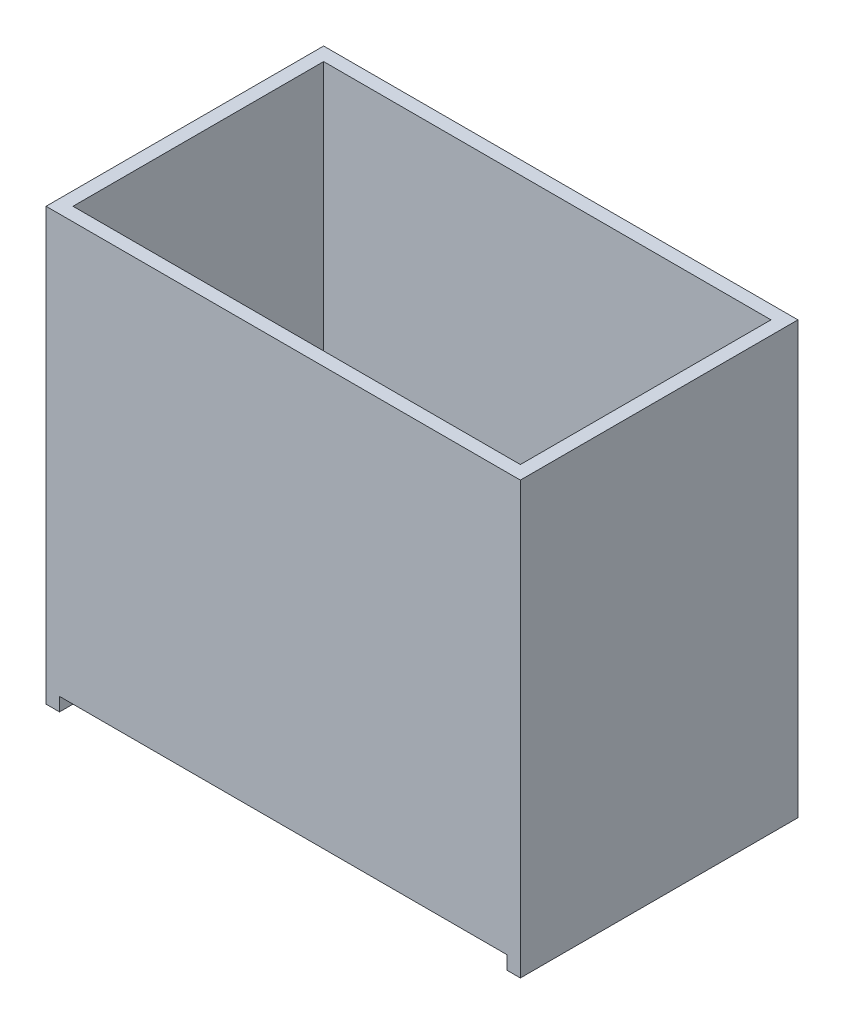
from build123d import *

# Parameters (mm, degrees)
SKETCH1_W           = 176
SKETCH1_H           = 103
SKETCH1_W_2         = 166
SKETCH1_H_2         = 93
BOSS_EXTRUDE1_DEPTH = 160
CUT_EXTRUDE1_REACH  = 261.201
SKETCH2_W           = 166
SKETCH2_H           = 5


with BuildPart() as part:
    # Sketch1 → Boss-Extrude1 (new body)
    with BuildSketch(Plane(origin=(0, 0, 0), x_dir=(1, 0, 0), z_dir=(0, 1, 0))):
        with Locations((88, 51.5)):
            Rectangle(SKETCH1_W, SKETCH1_H)
        with Locations((88, 51.5)):
            Rectangle(SKETCH1_W_2, SKETCH1_H_2, mode=Mode.SUBTRACT)
    extrude(amount=BOSS_EXTRUDE1_DEPTH)

    # Sketch2 → Cut-Extrude1 (cut, up to next)
    with BuildSketch(Plane.XY, mode=Mode.PRIVATE) as cut_extrude1_sk1:
        with Locations((88, 2.5)):
            Rectangle(SKETCH2_W, SKETCH2_H)
    cut_extrude1_tool1 = extrude(cut_extrude1_sk1.sketch, amount=-CUT_EXTRUDE1_REACH, mode=Mode.PRIVATE) & part.part
    add(cut_extrude1_tool1.solids().sort_by_distance((88, 2.5, 0))[0], mode=Mode.SUBTRACT)


solid = part.part
